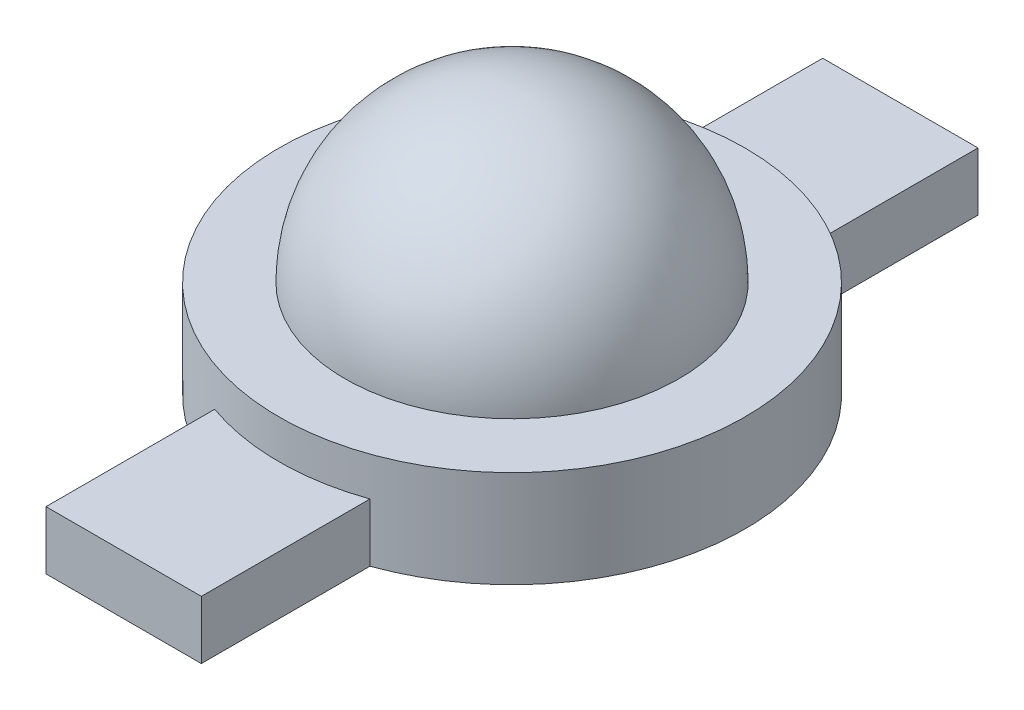
from build123d import *

# Parameters (mm, degrees)
BOSS_EXTRUDE1_DEPTH = 1.5


with BuildPart() as part:
    # Sketch1 → Revolve1 (revolve)
    with BuildSketch(Plane(origin=(0, 0, 0), x_dir=(0, 0, -1), z_dir=(1, 0, 0))):
        with BuildLine():
            Line((4.3, 0), (6, 0))
            Line((6, 0), (6, -2.5))
            Line((6, -2.5), (0, -2.5))
            Line((0, -2.5), (0, 4.3))
            ThreePointArc((0, 4.3), (3.040559159, 3.040559159), (4.3, 0))
        make_face()
    revolve(axis=Axis((0, -2.5, 0), (0, 1, 0)))

    # Sketch2 → Boss-Extrude1 (add)
    with BuildSketch(Plane.XZ.offset(2.5)):
        with BuildLine():
            Line((0, 10), (-2, 10))
            Line((-2, 10), (-2, 5.656854249))
            ThreePointArc((-2, 5.656854249), (0, 6), (2, 5.656854249))
            Line((2, 5.656854249), (2, 10))
            Line((2, 10), (0, 10))
        make_face()
        with BuildLine():
            Line((0, -10), (-2, -10))
            Line((-2, -10), (-2, -5.656854249))
            ThreePointArc((-2, -5.656854249), (0, -6), (2, -5.656854249))
            Line((2, -5.656854249), (2, -10))
            Line((2, -10), (0, -10))
        make_face()
    extrude(amount=-BOSS_EXTRUDE1_DEPTH)


solid = part.part
